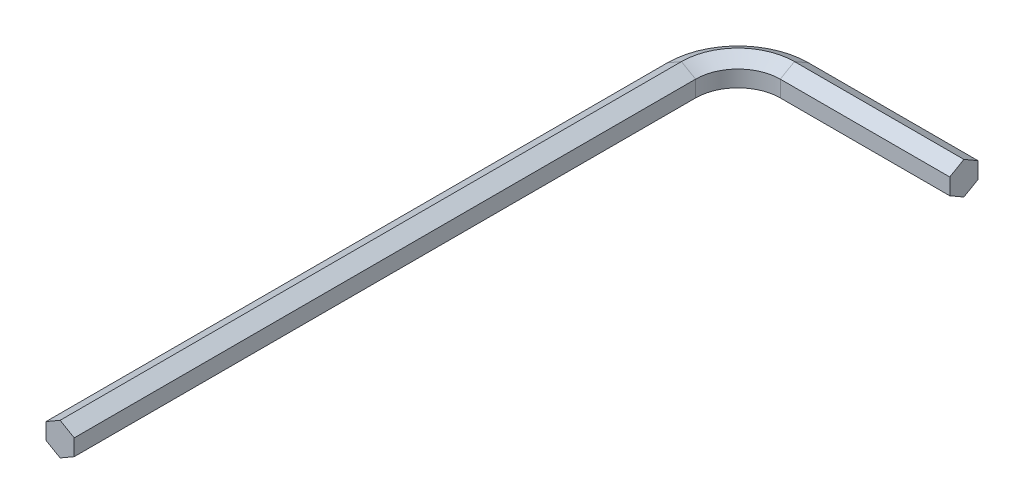
from build123d import *


with BuildPart() as part:
    # Sweep1: sweep along a path in Sketch1
    with BuildLine(Plane(origin=(0, 0, 0), x_dir=(1, 0, 0), z_dir=(0, 1, 0))) as sweep1_path:
        Line((0, 0), (0, 55))
        ThreePointArc((0, 55), (1.464466094, 58.535533906), (5, 60))
        Line((5, 60), (20, 60))
    # Sketch2 → Sweep1 (sweep)
    with BuildSketch(Plane.XY):
        Polygon((0, 1.443375673), (-1.25, 0.721687836), (-1.25, -0.721687836), (0, -1.443375673), (1.25, -0.721687836), (1.25, 0.721687836), align=None)
    sweep(path=sweep1_path.line)


solid = part.part
